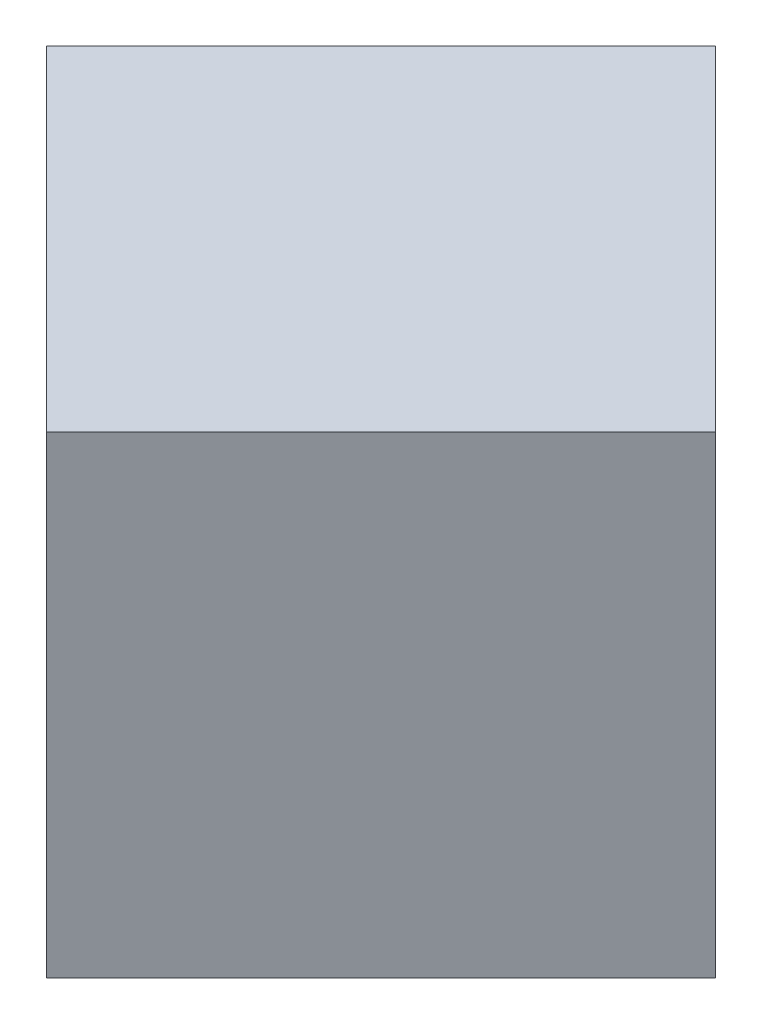
from build123d import *

# Parameters (mm, degrees)
EXTRUDE2_DEPTH = 99.997065


with BuildPart() as part:
    # Sketch2 → Extrude2 (new body)
    with BuildSketch(Plane(origin=(0, 0, 0), x_dir=(1, 0, 0), z_dir=(0, 1, 0))):
        Polygon((-70.708604504, 0), (0, -70.708604504), (70.708604504, 0), (0, 70.708604504), align=None)
    extrude(amount=EXTRUDE2_DEPTH)


solid = part.part
